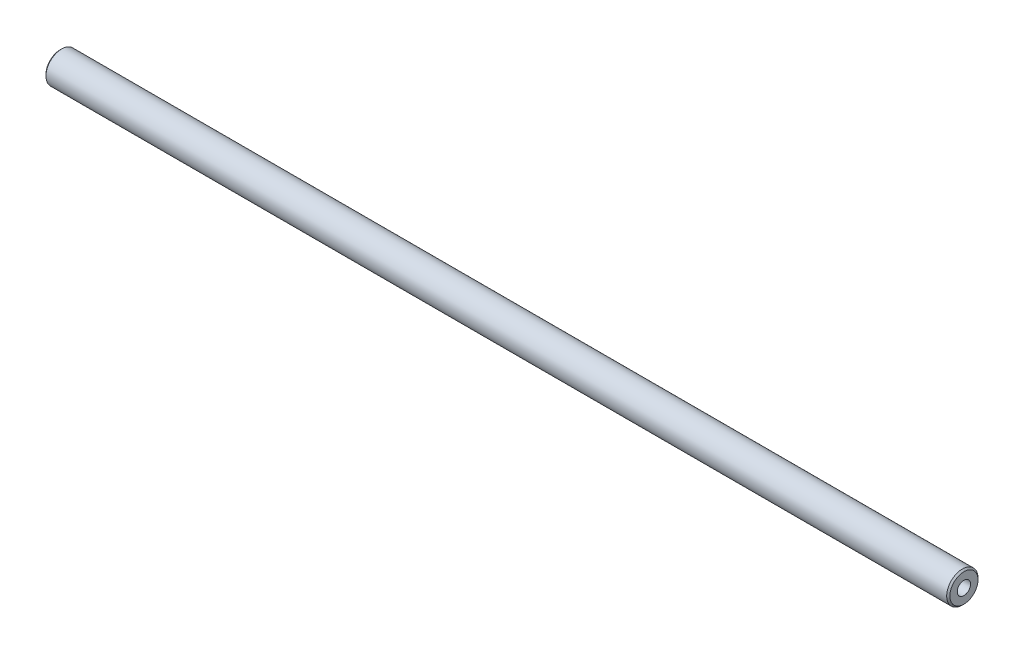
from build123d import *

# Parameters (mm, degrees)
SKETCH_1_R      = 10
EXTRUDE_1_DEPTH = 288.75
M10X1_5_1_D     = 8.5
M10X1_5_1_DEPTH = 24.5
M10X1_5_1_TIP   = 2.553657631
CHAMFER_1_SIZE  = 1


with BuildPart() as part:
    # 草图1 → 凸台-拉伸1 (new, symmetric)
    with BuildSketch(Plane(origin=(0, 0, 0), x_dir=(0, 0, -1), z_dir=(1, 0, 0))):
        Circle(SKETCH_1_R)
    extrude(amount=EXTRUDE_1_DEPTH, both=True)

    # M10x1.5 螺纹孔1
    with Locations(Plane(origin=(288.75, 0, 0), x_dir=(0, 0, -1), z_dir=(1, 0, 0))):
        with Locations((0, 0)):
            Hole(M10X1_5_1_D / 2, depth=M10X1_5_1_DEPTH)
            with Locations((0, 0, -(M10X1_5_1_DEPTH + M10X1_5_1_TIP / 2))):  # 118° drill point
                Cone(0, M10X1_5_1_D / 2, M10X1_5_1_TIP, mode=Mode.SUBTRACT)

    # 倒角1
    chamfer_1_edges = [part.edges().sort_by_distance(p)[0] for p in [
        (-288.75, 0, 10),
        (288.75, 0, 10),
    ]]
    chamfer(chamfer_1_edges, length=CHAMFER_1_SIZE)


solid = part.part
